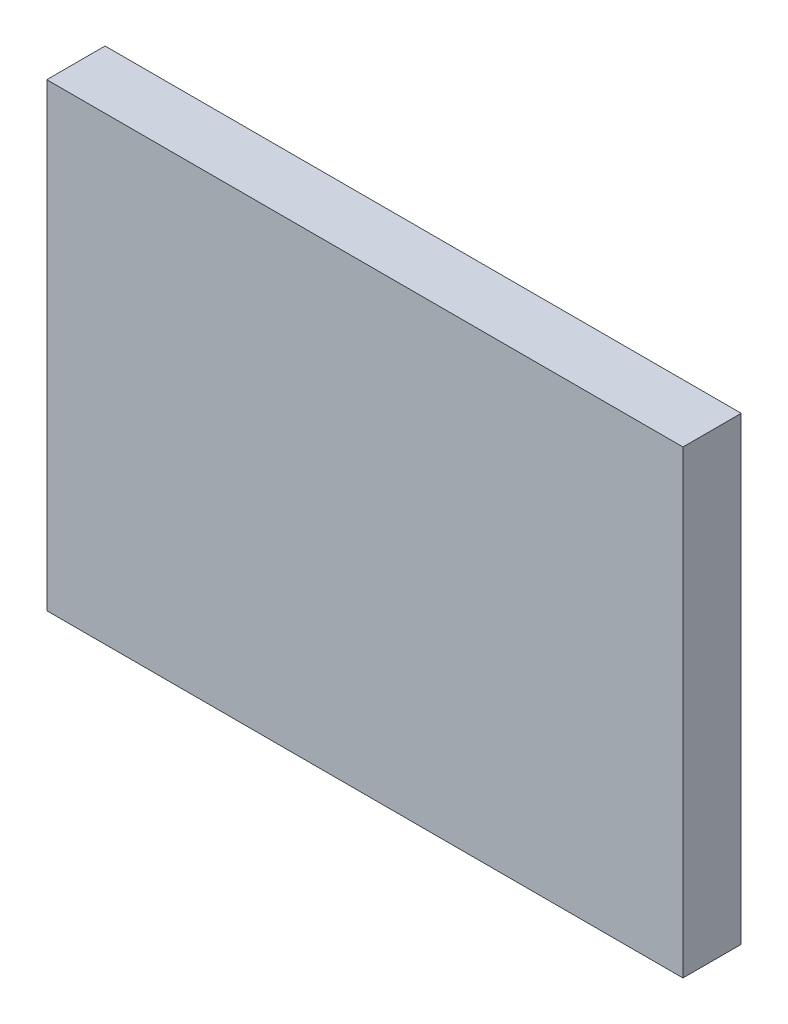
from build123d import *

# Parameters (mm, degrees)
SKIZZE1_W                       = 6.912
SKIZZE1_H                       = 3.888
AUFSATZ_LINEAR_AUSTRAGEN1_DEPTH = 1
SKIZZE2_W                       = 10.912
SKIZZE2_H                       = 7.888
AUFSATZ_LINEAR_AUSTRAGEN2_DEPTH = 1
AUFSATZ_LINEAR_AUSTRAGEN3_DEPTH = 0.48
SCHNITT_LINEAR_AUSTRAGEN1_DEPTH = 40.48
SKIZZE7_R                       = 0.1
SCHNITT_LINEAR_AUSTRAGEN2_DEPTH = 0.1
SKIZZE8_R                       = 0.1
SCHNITT_LINEAR_AUSTRAGEN3_DEPTH = 0.1


with BuildPart() as part:
    # Skizze1 → Aufsatz-Linear austragen1 (new body)
    with BuildSketch(Plane.XY):
        with Locations((3.456, 1.944)):
            Rectangle(SKIZZE1_W, SKIZZE1_H)
    extrude(amount=AUFSATZ_LINEAR_AUSTRAGEN1_DEPTH)

    # Skizze2 → Aufsatz-Linear austragen2 (add)
    with BuildSketch(Plane.XY.offset(1)):
        with Locations((3.456, 1.944)):
            Rectangle(SKIZZE2_W, SKIZZE2_H)
    extrude(amount=AUFSATZ_LINEAR_AUSTRAGEN2_DEPTH)

    # Skizze3 → Aufsatz-Linear austragen3 (add)
    with BuildSketch(Plane(origin=(0, 0, 0), x_dir=(-1, 0, 0), z_dir=(0, 0, -1))):
        Polygon((-3.956, 1.944), (-3.456, 2.444), (-2.961061255, 1.949061255), (-3.461061255, 1.449061255), align=None)
    extrude(amount=AUFSATZ_LINEAR_AUSTRAGEN3_DEPTH)

    # Skizze6 → Schnitt-Linear austragen1 (cut)
    with BuildSketch(Plane(origin=(1.006, -1.006, 0), x_dir=(0, 0, -1), z_dir=(0.7071067811865474, -0.7071067811865477, 0))):
        Polygon((0.48, 4.171930009), (0.24, 3.821955466), (0.48, 3.471980924), align=None)
    extrude(amount=-SCHNITT_LINEAR_AUSTRAGEN1_DEPTH, mode=Mode.SUBTRACT)

    # Skizze7 → Schnitt-Linear austragen2 (cut)
    with BuildSketch(Plane(origin=(0.943569205, 0.943569205, -1.945870659), x_dir=(-0.916554971633356, 0.17448706179529924, -0.35983503059071614), z_dir=(0.3999087195525726, 0.3999087195525724, -0.8247096653075213))):
        with Locations(Location((-2.60892888, 1.483064665, 0), (0, 0, 349.02546357))):
            Circle(SKIZZE7_R)
    extrude(amount=-SCHNITT_LINEAR_AUSTRAGEN2_DEPTH, mode=Mode.SUBTRACT)

    # Skizze8 → Schnitt-Linear austragen3 (cut)
    with BuildSketch(Plane(origin=(0.785261084, 0.785261084, 1.619400564), x_dir=(-0.916554971633356, 0.17448706179529927, 0.3598350305907162), z_dir=(-0.3999087195525727, -0.3999087195525724, -0.8247096653075213))):
        with Locations(Location((-3.051649182, 2.019884252, 0), (0, 0, 349.02546357))):
            Circle(SKIZZE8_R)
    extrude(amount=-SCHNITT_LINEAR_AUSTRAGEN3_DEPTH, mode=Mode.SUBTRACT)


solid = part.part
